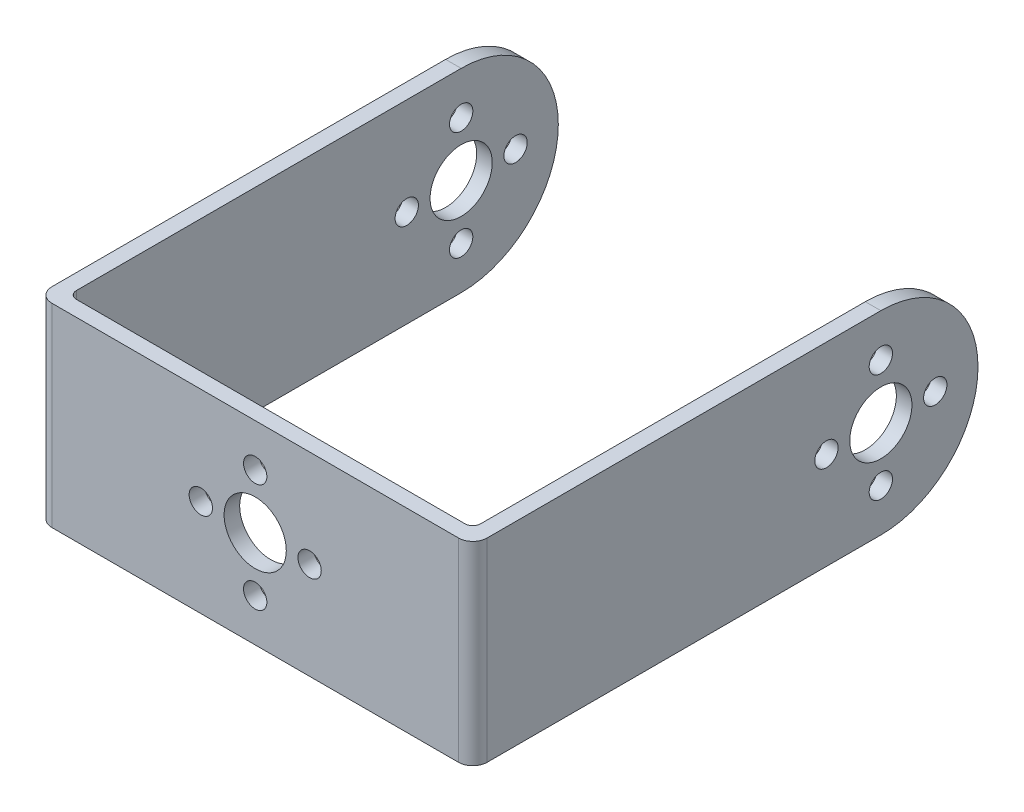
from build123d import *

# Parameters (mm, degrees)
SALIENTE_EXTRUIR2_DEPTH = 25
CROQUIS2_R              = 4
CROQUIS2_R_2            = 1.5
CORTAR_EXTRUIR1_DEPTH   = 10
CROQUIS3_R              = 4
CROQUIS3_R_2            = 1.5
CORTAR_EXTRUIR2_DEPTH   = 60


with BuildPart() as part:
    # Croquis1 → Saliente-Extruir2 (new body)
    with BuildSketch(Plane(origin=(0, 0, 0), x_dir=(1, 0, 0), z_dir=(0, 1, 0))):
        with BuildLine():
            Line((0, 1.84), (0, 65))
            Line((0, 65), (2, 65))
            Line((2, 65), (2, 3))
            ThreePointArc((2, 3), (2.292893219, 2.292893219), (3, 2))
            Line((3, 2), (53, 2))
            ThreePointArc((53, 2), (53.707106781, 2.292893219), (54, 3))
            Line((54, 3), (54, 65))
            Line((54, 65), (56, 65))
            Line((56, 65), (56, 1.84))
            ThreePointArc((56, 1.84), (55.461076477, 0.538923523), (54.16, 0))
            Line((54.16, 0), (1.84, 0))
            ThreePointArc((1.84, 0), (0.538923523, 0.538923523), (0, 1.84))
        make_face()
    extrude(amount=SALIENTE_EXTRUIR2_DEPTH)

    # Croquis2 → Cortar-Extruir1 (cut)
    with BuildSketch(Plane.XY):
        with Locations((28, 12.5)):
            Circle(CROQUIS2_R)
        with Locations((28, 19.5)):
            Circle(CROQUIS2_R_2)
        with Locations((28, 5.5)):
            Circle(CROQUIS2_R_2)
        with Locations((35, 12.5)):
            Circle(CROQUIS2_R_2)
        with Locations((21, 12.5)):
            Circle(CROQUIS2_R_2)
    extrude(amount=-CORTAR_EXTRUIR1_DEPTH, mode=Mode.SUBTRACT)

    # Croquis3 → Cortar-Extruir2 (cut)
    with BuildSketch(Plane(origin=(56, 0, 0), x_dir=(0, 0, -1), z_dir=(1, 0, 0))):
        with BuildLine():
            Line((65, 25), (52.5, 25))
            ThreePointArc((52.5, 25), (61.338834765, 21.338834765), (65, 12.5))
            Line((65, 12.5), (65, 25))
        make_face()
        with BuildLine():
            Line((65, 0), (65, 12.5))
            ThreePointArc((65, 12.5), (61.338834765, 3.661165235), (52.5, 0))
            Line((52.5, 0), (65, 0))
        make_face()
        with Locations((52.5, 12.5)):
            Circle(CROQUIS3_R)
        with Locations((45.5, 12.5)):
            Circle(CROQUIS3_R_2)
        with Locations((52.5, 19.5)):
            Circle(CROQUIS3_R_2)
        with Locations((59.5, 12.5)):
            Circle(CROQUIS3_R_2)
        with Locations((52.5, 5.5)):
            Circle(CROQUIS3_R_2)
    extrude(amount=-CORTAR_EXTRUIR2_DEPTH, mode=Mode.SUBTRACT)


solid = part.part
